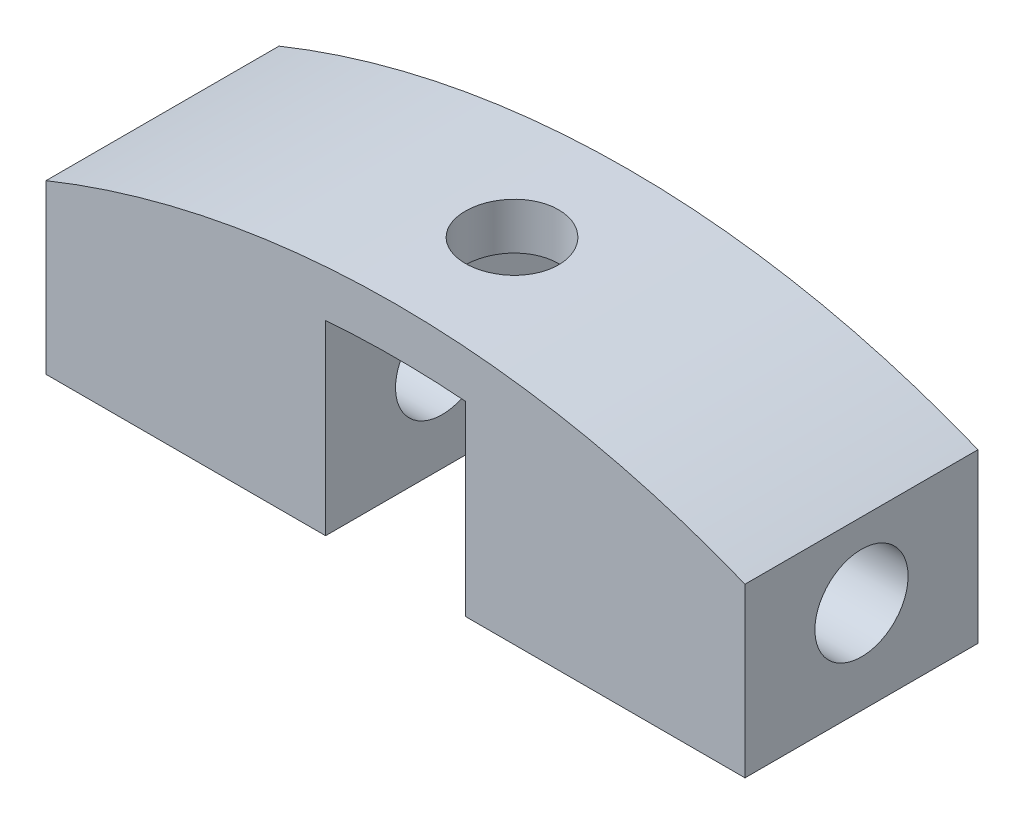
from build123d import *

# Parameters (mm, degrees)
BOSS_EXTRUDE1_DEPTH     = 10
CUT_EXTRUDE2_DEPTH      = 45.988887517
CUT_EXTRUDE2_DEPTH_BACK = 45.988887517
SKETCH5_R               = 2
CUT_EXTRUDE3_DEPTH      = 44.874821937


with BuildPart() as part:
    # Sketch1 → Boss-Extrude1 (new body)
    with BuildSketch(Plane.XY):
        with BuildLine():
            ThreePointArc((-15, 37.080992435), (0, 40), (15, 37.080992435))
            Line((15, 37.080992435), (15, 29.88139385))
            Line((15, 29.88139385), (3, 29.88139385))
            Line((3, 29.88139385), (3, 37.88139385))
            ThreePointArc((3, 37.88139385), (0, 38), (-3, 37.88139385))
            Line((-3, 37.88139385), (-3, 29.88139385))
            Line((-3, 29.88139385), (-15, 29.88139385))
            Line((-15, 29.88139385), (-15, 37.080992435))
        make_face()
    extrude(amount=-BOSS_EXTRUDE1_DEPTH)

    # Sketch4 → Cut-Extrude2 (cut, two sides: drawn at the far end of the back side and taken through both)
    with BuildSketch(Plane(origin=(-3, 0, 0), x_dir=(0, 0, -1), z_dir=(1, 0, 0)).offset(-CUT_EXTRUDE2_DEPTH_BACK)):
        with BuildLine():
            ThreePointArc((3, 33.88139385), (5, 31.88139385), (7, 33.88139385))
            Line((7, 33.88139385), (3, 33.88139385))
        make_face()
        with BuildLine():
            Line((3, 33.88139385), (7, 33.88139385))
            ThreePointArc((7, 33.88139385), (5, 35.88139385), (3, 33.88139385))
        make_face()
    extrude(amount=CUT_EXTRUDE2_DEPTH + CUT_EXTRUDE2_DEPTH_BACK, mode=Mode.SUBTRACT)

    # Sketch5 → Cut-Extrude3 (cut, through all)
    with BuildSketch(Plane(origin=(0, 0, 0), x_dir=(1, 0, 0), z_dir=(0, 1, 0))):
        with Locations(Location((0, 5, 0), (0, 0, 90))):
            Circle(SKETCH5_R)
    extrude(amount=CUT_EXTRUDE3_DEPTH, mode=Mode.SUBTRACT)


solid = part.part
